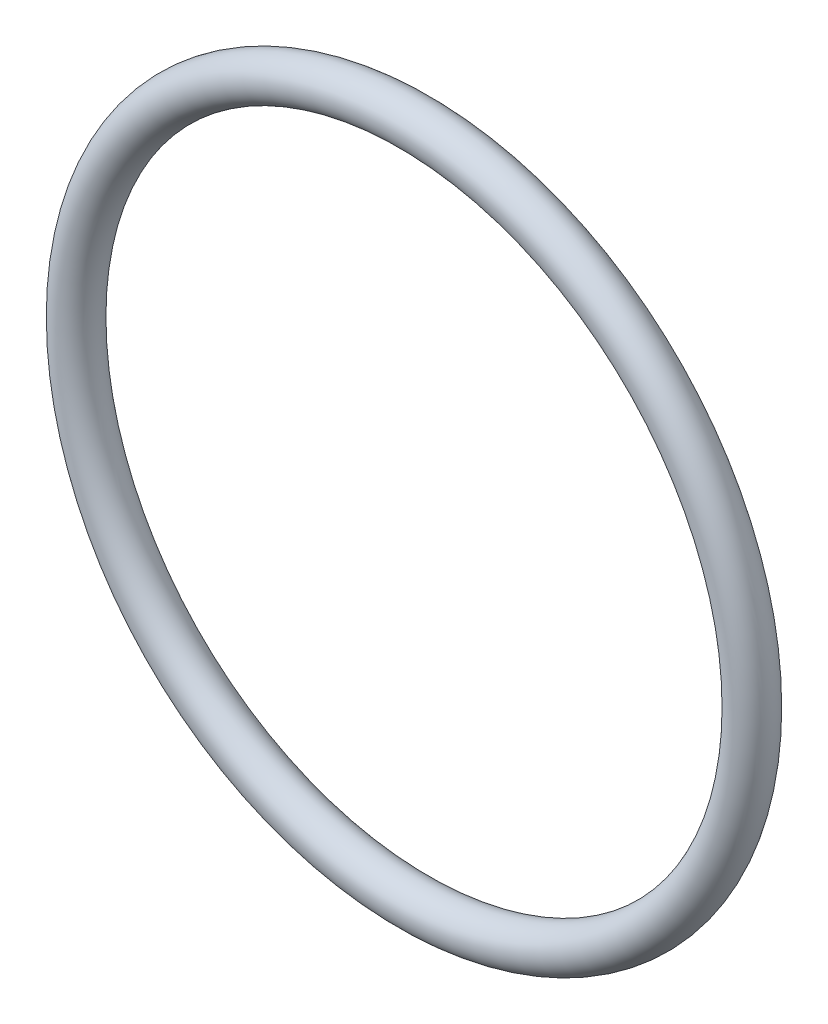
from build123d import *

# Parameters (mm, degrees)
SKETCH1_R = 0.889


with BuildPart() as part:
    # Sketch1 → Revolve1 (revolve)
    with BuildSketch(Plane(origin=(0, 0, 0), x_dir=(0, -1, 0), z_dir=(1, 0, 0)), mode=Mode.PRIVATE) as revolve1_sk:
        with Locations((14.2367, 0)):
            Circle(SKETCH1_R)
    revolve(revolve1_sk.sketch.rotate(Axis((0, 0, 0.889), (0, 0, -1)), 270), axis=Axis((0, 0, 0.889), (0, 0, -1)))


solid = part.part
